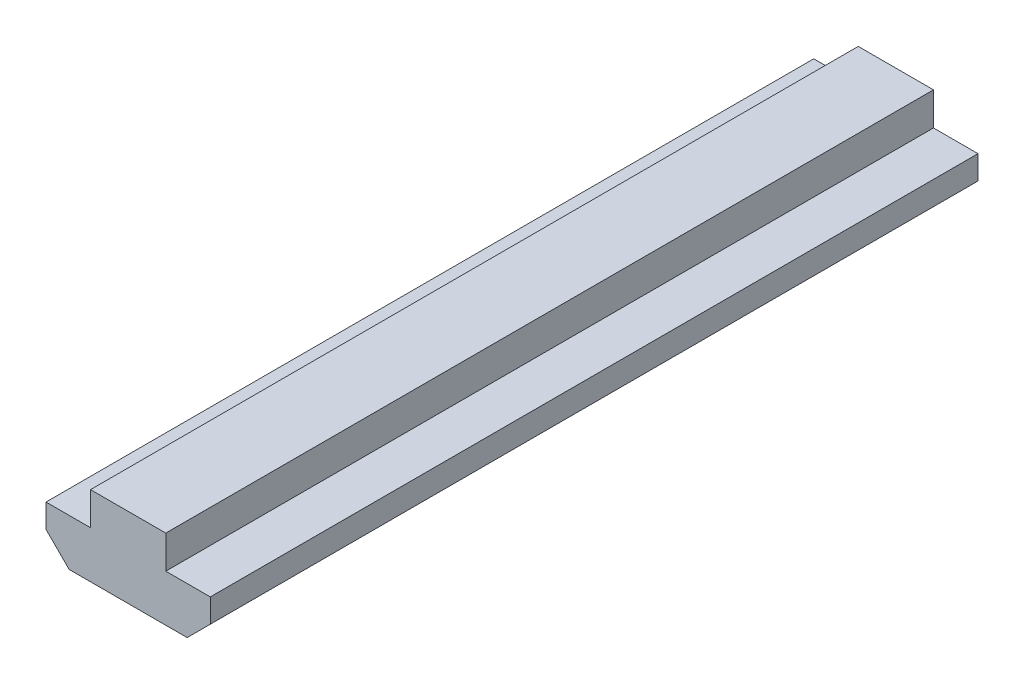
from build123d import *

# Parameters (mm, degrees)
EXTRUDE_1_DEPTH = 100


with BuildPart() as part:
    # 草图1 → 凸台-拉伸1 (new body)
    with BuildSketch(Plane.XY):
        Polygon((15.6, 4.3), (15.6, 0), (21.4, 0), (21.4, -3.085), (18.385, -6.1), (3.015, -6.1), (0, -3.085), (0, 0), (5.8, 0), (5.8, 4.3), align=None)
    extrude(amount=EXTRUDE_1_DEPTH)


solid = part.part
